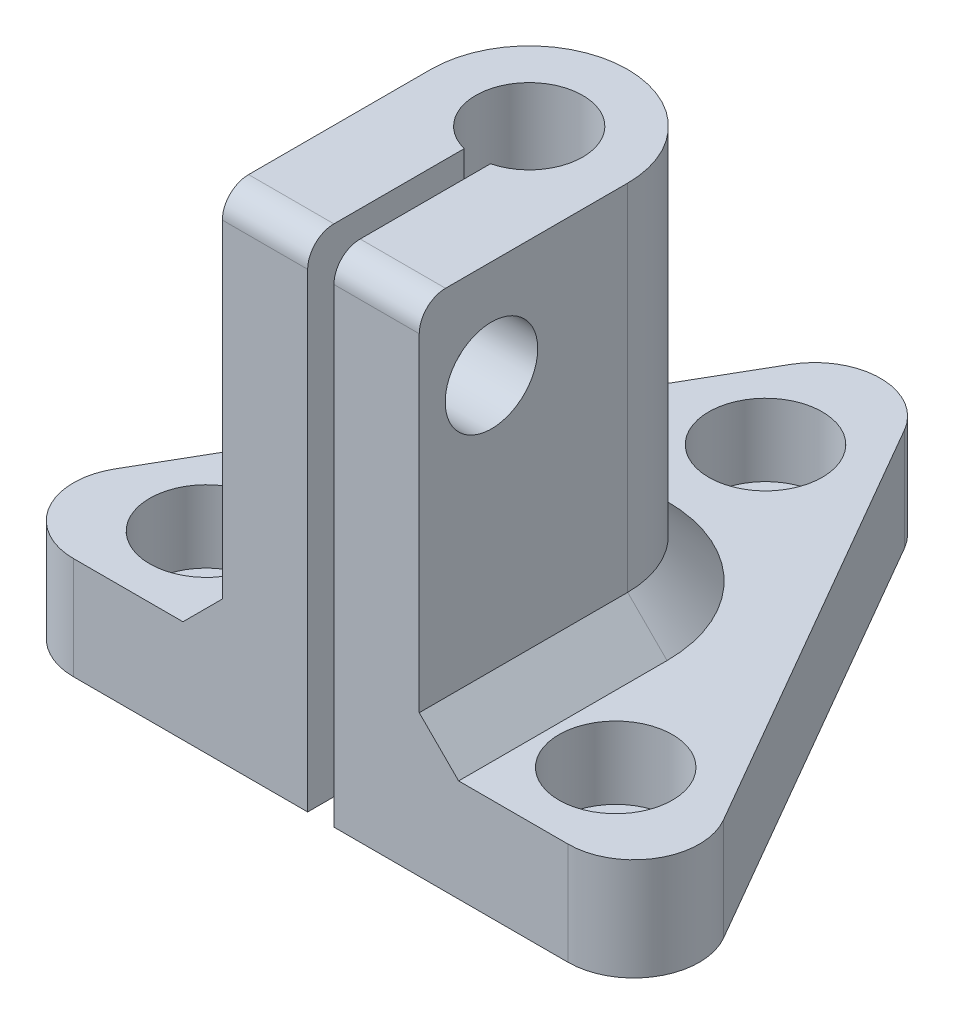
from build123d import *

# Parameters (mm, degrees)
ESQUISSE5_R              = 2.6
BOSS_EXTRU_2_DEPTH       = 7.8
ESQUISSE6_R              = 7.5
BOSS_EXTRU_3_DEPTH       = 30
BOSS_EXTRU_6_START       = -30
BOSS_EXTRU_6_DEPTH       = 30
ESQUISSE14_R             = 4.075
ENL_V_MAT_EXTRU_4_DEPTH  = 57.510382527
ENL_V_MAT_EXTRU_5_DEPTH  = 57.510382527
CONG_2_R                 = 5
ESQUISSE17_R             = 2.075
ENL_V_MAT_EXTRU_6_DEPTH  = 56.917889465
ENL_V_MAT_EXTRU_7_DEPTH  = 3.25
CHANFREIN1_SIZE          = 3
ESQUISSE20_R             = 3.525
ENL_V_MAT_EXTRU_9_DEPTH  = 4.97
CONG_3_R                 = 2
ESQUISSE19_R             = 4.325
ENL_V_MAT_EXTRU_8_DEPTH  = 5.5
ENL_V_MAT_EXTRU_10_DEPTH = 54.291595842


with BuildPart() as part:
    # Esquisse5 → Boss.-Extru.2 (new body)
    with BuildSketch(Plane(origin=(0, 0, 0), x_dir=(1, 0, 0), z_dir=(0, 1, 0))):
        Polygon((-27.5, -15.877132403), (27.5, -15.877132403), (0, 31.754264805), align=None)
        with Locations(Location((0, 18, 0), (0, 0, 270))):
            Circle(ESQUISSE5_R, mode=Mode.SUBTRACT)
        with Locations(Location((-15.588457268, -9, 0), (0, 0, 270))):
            Circle(ESQUISSE5_R, mode=Mode.SUBTRACT)
        with Locations(Location((15.588457268, -9, 0), (0, 0, 270))):
            Circle(ESQUISSE5_R, mode=Mode.SUBTRACT)
    extrude(amount=BOSS_EXTRU_2_DEPTH)

    # Esquisse6 → Boss.-Extru.3 (add)
    with BuildSketch(Plane(origin=(0, 7.8, 0), x_dir=(1, 0, 0), z_dir=(0, 1, 0))):
        with Locations(Location((0, 0, 0), (0, 0, 270))):
            Circle(ESQUISSE6_R)
    extrude(amount=BOSS_EXTRU_3_DEPTH)

    # Esquisse13 → Boss.-Extru.6 (add)
    with BuildSketch(Plane(origin=(0, 37.8, 0), x_dir=(1, 0, 0), z_dir=(0, 1, 0)).offset(BOSS_EXTRU_6_START)):
        with BuildLine():
            Line((-7.5, 0), (-7.5, -15.877132403))
            Line((-7.5, -15.877132403), (7.5, -15.877132403))
            Line((7.5, -15.877132403), (7.5, 0))
            ThreePointArc((7.5, 0), (0, -7.5), (-7.5, 0))
        make_face()
    extrude(amount=BOSS_EXTRU_6_DEPTH)

    # Esquisse14 → Enlèv. mat.-Extru.4 (cut, through all)
    with BuildSketch(Plane(origin=(0, 37.8, 0), x_dir=(1, 0, 0), z_dir=(0, 1, 0))):
        with Locations(Location((0, 0, 0), (0, 0, 270))):
            Circle(ESQUISSE14_R)
    extrude(amount=-ENL_V_MAT_EXTRU_4_DEPTH, mode=Mode.SUBTRACT)

    # Esquisse15 → Enlèv. mat.-Extru.5 (cut, through all)
    with BuildSketch(Plane(origin=(0, 37.8, 0), x_dir=(1, 0, 0), z_dir=(0, 1, 0))):
        with BuildLine():
            Line((-1, -3.95039555), (-1, -15.877132403))
            Line((-1, -15.877132403), (1, -15.877132403))
            Line((1, -15.877132403), (1, -3.95039555))
            ThreePointArc((1, -3.95039555), (0, -4.075), (-1, -3.95039555))
        make_face()
    extrude(amount=-ENL_V_MAT_EXTRU_5_DEPTH, mode=Mode.SUBTRACT)

    # Congé2
    cong_2_edges = [part.edges().sort_by_distance(p)[0] for p in [
        (0, 3.9, -31.754264805),
        (27.5, 3.9, 15.877132403),
        (-27.5, 3.9, 15.877132403),
    ]]
    fillet(cong_2_edges, radius=CONG_2_R)

    # Esquisse17 → Enlèv. mat.-Extru.6 (cut, through all)
    with BuildSketch(Plane(origin=(7.5, 0, 0), x_dir=(0, 0, -1), z_dir=(1, 0, 0))):
        with Locations((-10.377132403, 30.3)):
            Circle(ESQUISSE17_R)
    extrude(amount=-ENL_V_MAT_EXTRU_6_DEPTH, mode=Mode.SUBTRACT)

    # Esquisse18 → Enlèv. mat.-Extru.7 (cut)
    with BuildSketch(Plane.ZY.offset(7.5)):
        Polygon((12.412292102, 33.825), (8.341972704, 33.825), (6.306813005, 30.3), (8.341972704, 26.775), (12.412292102, 26.775), (14.447451801, 30.3), align=None)
    extrude(amount=-ENL_V_MAT_EXTRU_7_DEPTH, mode=Mode.SUBTRACT)

    # Chanfrein1
    chanfrein1_edges = [part.edges().sort_by_distance(p)[0] for p in [
        (0, 7.8, -7.5),
        (7.5, 7.8, 7.938566201),
        (-7.5, 7.8, 7.938566201),
    ]]
    chamfer(chanfrein1_edges, length=CHANFREIN1_SIZE)

    # Esquisse20 → Enlèv. mat.-Extru.9 (cut)
    with BuildSketch(Plane(origin=(7.5, 0, 0), x_dir=(0, 0, -1), z_dir=(1, 0, 0))):
        with Locations((-10.377132403, 30.3)):
            Circle(ESQUISSE20_R)
    extrude(amount=-ENL_V_MAT_EXTRU_9_DEPTH, mode=Mode.SUBTRACT)

    # Congé3
    cong_3_edges = [part.edges().sort_by_distance(p)[0] for p in [
        (-4.25, 37.8, 15.877132403),
        (4.25, 37.8, 15.877132403),
    ]]
    fillet(cong_3_edges, radius=CONG_3_R)

    # Esquisse19 → Enlèv. mat.-Extru.8 (cut)
    with BuildSketch(Plane(origin=(0, 7.8, 0), x_dir=(1, 0, 0), z_dir=(0, 1, 0))):
        with Locations(Location((0, 18, 0), (0, 0, 270))):
            Circle(ESQUISSE19_R)
        with Locations(Location((-15.588457268, -9, 0), (0, 0, 270))):
            Circle(ESQUISSE19_R)
        with Locations(Location((15.588457268, -9, 0), (0, 0, 270))):
            Circle(ESQUISSE19_R)
    extrude(amount=-ENL_V_MAT_EXTRU_8_DEPTH, mode=Mode.SUBTRACT)

    # Esquisse21 → Enlèv. mat.-Extru.10 (cut, through all)
    with BuildSketch(Plane(origin=(2.53, 0, 0), x_dir=(0, 0, -1), z_dir=(1, 0, 0))):
        Polygon((-11.336300266, 32.140005981), (-10.377132403, 32.640005981), (-9.417964539, 32.140005981), align=None)
    extrude(amount=-ENL_V_MAT_EXTRU_10_DEPTH, mode=Mode.SUBTRACT)


solid = part.part
